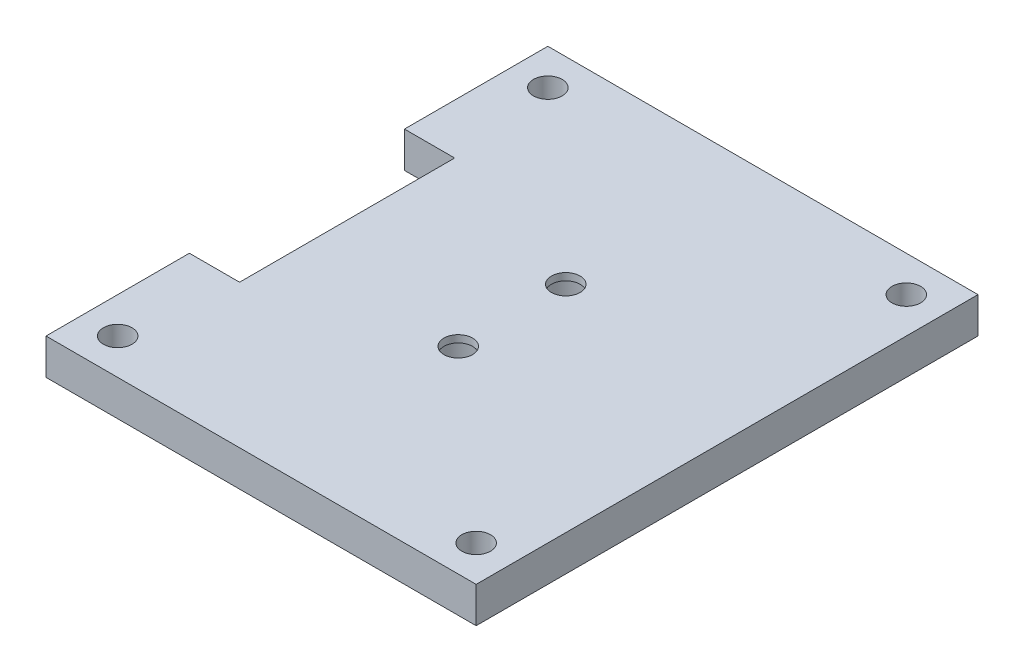
from build123d import *

# Parameters (mm, degrees)
SKETCH1_R           = 2
BOSS_EXTRUDE1_DEPTH = 5
SKETCH3_R           = 4
CUT_EXTRUDE1_DEPTH  = 4
SKETCH3_4_R         = 2
CUT_EXTRUDE2_DEPTH  = 47.368092477


with BuildPart() as part:
    # Sketch1 → Boss-Extrude1 (new body)
    with BuildSketch(Plane(origin=(0, 0, 0), x_dir=(1, 0, 0), z_dir=(0, 1, 0))):
        Polygon((-30, 35), (-30, 15), (-23, 15), (-23, -15), (-30, -15), (-30, -35), (30, -35), (30, 35), align=None)
        with Locations((-25, -30)):
            Circle(SKETCH1_R, mode=Mode.SUBTRACT)
        with Locations((25, -30)):
            Circle(SKETCH1_R, mode=Mode.SUBTRACT)
        with Locations((-25, 30)):
            Circle(SKETCH1_R, mode=Mode.SUBTRACT)
        with Locations((25, 30)):
            Circle(SKETCH1_R, mode=Mode.SUBTRACT)
    extrude(amount=BOSS_EXTRUDE1_DEPTH)

    # Sketch3 → Cut-Extrude1 (cut)
    with BuildSketch(Plane.XZ):
        with Locations((0, 7.5)):
            Circle(SKETCH3_R)
        with Locations((0, -7.5)):
            Circle(SKETCH3_R)
    extrude(amount=-CUT_EXTRUDE1_DEPTH, mode=Mode.SUBTRACT)

    # Sketch3<4> → Cut-Extrude2 (cut, through all)
    with BuildSketch(Plane.XZ):
        with Locations((0, -7.5)):
            Circle(SKETCH3_4_R)
        with Locations((0, 7.5)):
            Circle(SKETCH3_4_R)
    extrude(amount=-CUT_EXTRUDE2_DEPTH, mode=Mode.SUBTRACT)


solid = part.part
